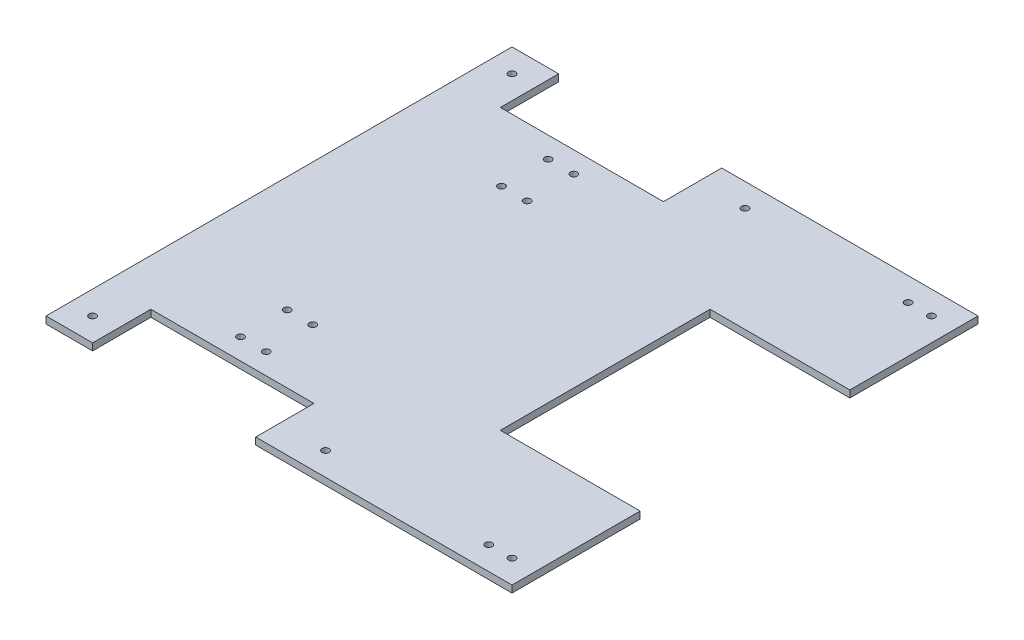
from build123d import *

# Parameters (mm, degrees)
BOSS_EXTRUDE1_DEPTH = 3
SKETCH2_R           = 1.5
CUT_EXTRUDE1_DEPTH  = 3
SKETCH6_R           = 1.5
CUT_EXTRUDE2_DEPTH  = 3
SKETCH8_W           = 60
SKETCH8_H           = 90
CUT_EXTRUDE4_DEPTH  = 3
SKETCH3_R           = 1.5
CUT_EXTRUDE5_DEPTH  = 3


with BuildPart() as part:
    # Sketch1 → Boss-Extrude1 (new body)
    with BuildSketch(Plane(origin=(0, 0, 0), x_dir=(1, 0, 0), z_dir=(0, 1, 0))):
        Polygon((-20, -130), (0, -130), (0, -105), (70, -105), (70, -130), (180, -130), (180, 70), (70, 70), (70, 45), (0, 45), (0, 70), (-20, 70), align=None)
    extrude(amount=BOSS_EXTRUDE1_DEPTH)

    # Sketch2 → Cut-Extrude1 (cut)
    with BuildSketch(Plane(origin=(0, 3, 0), x_dir=(1, 0, 0), z_dir=(0, 1, 0))):
        with Locations(Location((29.5, -96, 0), (0, 0, 270))):
            Circle(SKETCH2_R)
        with Locations(Location((29.5, -76, 0), (0, 0, 270))):
            Circle(SKETCH2_R)
        with Locations(Location((40.5, -96, 0), (0, 0, 90))):
            Circle(SKETCH2_R)
        with Locations(Location((40.5, -76, 0), (0, 0, 90))):
            Circle(SKETCH2_R)
        with Locations(Location((29.5, 36, 0), (0, 0, 90))):
            Circle(SKETCH2_R)
        with Locations(Location((40.5, 36, 0), (0, 0, 270))):
            Circle(SKETCH2_R)
        with Locations(Location((40.5, 16, 0), (0, 0, 270))):
            Circle(SKETCH2_R)
        with Locations(Location((29.5, 16, 0), (0, 0, 90))):
            Circle(SKETCH2_R)
    extrude(amount=-CUT_EXTRUDE1_DEPTH, mode=Mode.SUBTRACT)

    # Sketch6 → Cut-Extrude2 (cut)
    with BuildSketch(Plane(origin=(0, 3, 0), x_dir=(1, 0, 0), z_dir=(0, 1, 0))):
        with Locations(Location((170, -120, 0), (0, 0, 270))):
            Circle(SKETCH6_R)
        with Locations(Location((170, 60, 0), (0, 0, 90))):
            Circle(SKETCH6_R)
        with Locations(Location((90, -120, 0), (0, 0, 90))):
            Circle(SKETCH6_R)
        with Locations(Location((90, 60, 0), (0, 0, 270))):
            Circle(SKETCH6_R)
    extrude(amount=-CUT_EXTRUDE2_DEPTH, mode=Mode.SUBTRACT)

    # Sketch8 → Cut-Extrude4 (cut)
    with BuildSketch(Plane(origin=(0, 3, 0), x_dir=(1, 0, 0), z_dir=(0, 1, 0))):
        with Locations((150, -30)):
            Rectangle(SKETCH8_W, SKETCH8_H)
    extrude(amount=-CUT_EXTRUDE4_DEPTH, mode=Mode.SUBTRACT)

    # Sketch3 → Cut-Extrude5 (cut)
    with BuildSketch(Plane(origin=(0, 3, 0), x_dir=(1, 0, 0), z_dir=(0, 1, 0))):
        with Locations(Location((-10, -120, 0), (0, 0, 270))):
            Circle(SKETCH3_R)
        with Locations(Location((160, -120, 0), (0, 0, 270))):
            Circle(SKETCH3_R)
        with Locations(Location((160, 60, 0), (0, 0, 90))):
            Circle(SKETCH3_R)
        with Locations(Location((-10, 60, 0), (0, 0, 90))):
            Circle(SKETCH3_R)
    extrude(amount=-CUT_EXTRUDE5_DEPTH, mode=Mode.SUBTRACT)


solid = part.part
